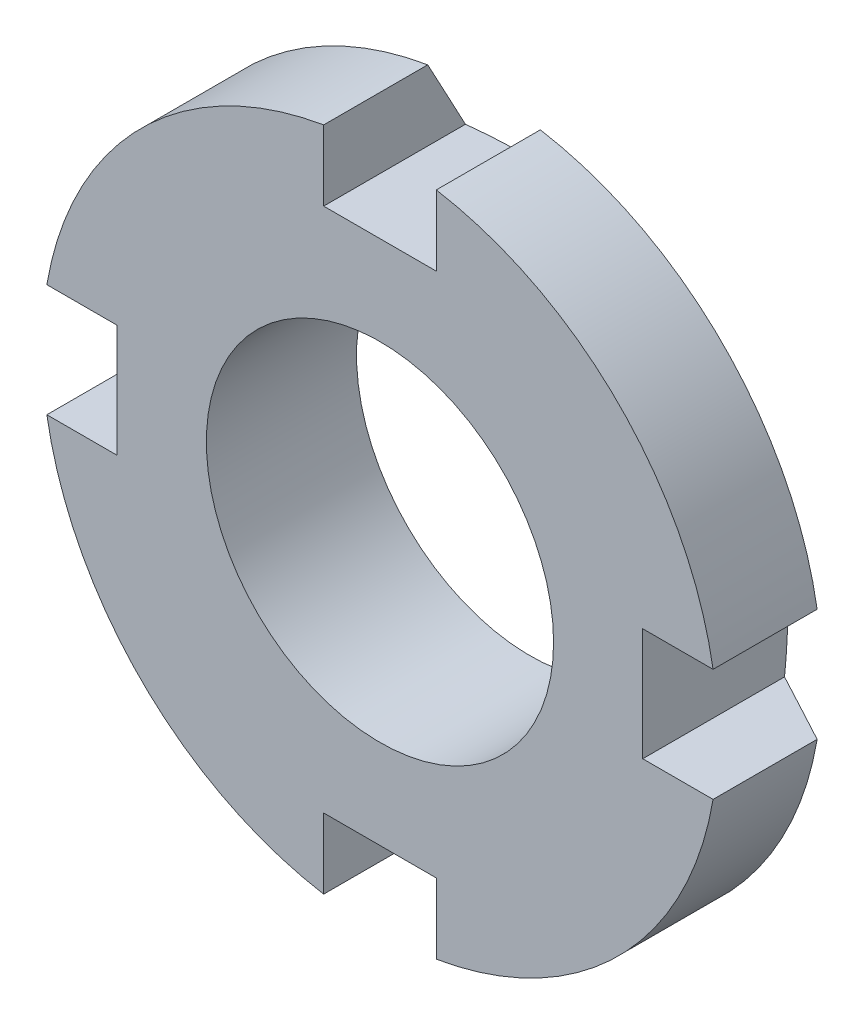
from build123d import *

# Parameters (mm, degrees)
SKETCH1_R              = 9
BOSS_EXTRUDE1_DEPTH    = 4
SKETCH3_W              = 3
SKETCH3_H              = 2
CUT_EXTRUDE1_DEPTH     = 14.341664064
CIRPATTERN1_COUNT      = 4
M10X1_0_TAPPED_HOLE1_D = 9
SKETCH4_R              = 4.625
CUT_EXTRUDE2_DEPTH     = 14.171939872


with BuildPart() as part:
    # Sketch1 → Boss-Extrude1 (new body)
    with BuildSketch(Plane.XY):
        Circle(SKETCH1_R)
    extrude(amount=BOSS_EXTRUDE1_DEPTH)

    # Sketch3 → Cut-Extrude1 (cut, through all)
    with BuildSketch(Plane.XY.offset(4)):
        with Locations((0, 8)):
            Rectangle(SKETCH3_W, SKETCH3_H)
    cut_extrude1 = extrude(amount=-CUT_EXTRUDE1_DEPTH, mode=Mode.SUBTRACT)

    # CirPattern1: Cut-Extrude1 ×4 about axis
    cirpattern1_axis = Axis((0, 0, 0), (0, 0, 1))
    for i in range(1, CIRPATTERN1_COUNT):
        add(cut_extrude1.rotate(cirpattern1_axis, i * 360 / CIRPATTERN1_COUNT), mode=Mode.SUBTRACT)

    # Sketch2 → Cut-Revolve1 (revolve, cut)
    with BuildSketch(Plane(origin=(0, 0, 0), x_dir=(0, 0, -1), z_dir=(1, 0, 0)), mode=Mode.PRIVATE) as cut_revolve1_sk:
        Polygon((-1.227731474, 9), (0, 6.75), (0, 9), align=None)
    revolve(cut_revolve1_sk.sketch.rotate(Axis((0, 0, 4.2), (0, 0, -1)), 90), axis=Axis((0, 0, 4.2), (0, 0, -1)), mode=Mode.SUBTRACT)

    # M10x1.0 Tapped Hole1 (through all)
    with Locations(Plane.XY.offset(4)):
        with Locations((0, 0)):
            Hole(M10X1_0_TAPPED_HOLE1_D / 2)

    # Sketch4 → Cut-Extrude2 (cut, through all)
    with BuildSketch(Plane.XY.offset(4)):
        Circle(SKETCH4_R)
    extrude(amount=-CUT_EXTRUDE2_DEPTH, mode=Mode.SUBTRACT)


solid = part.part
